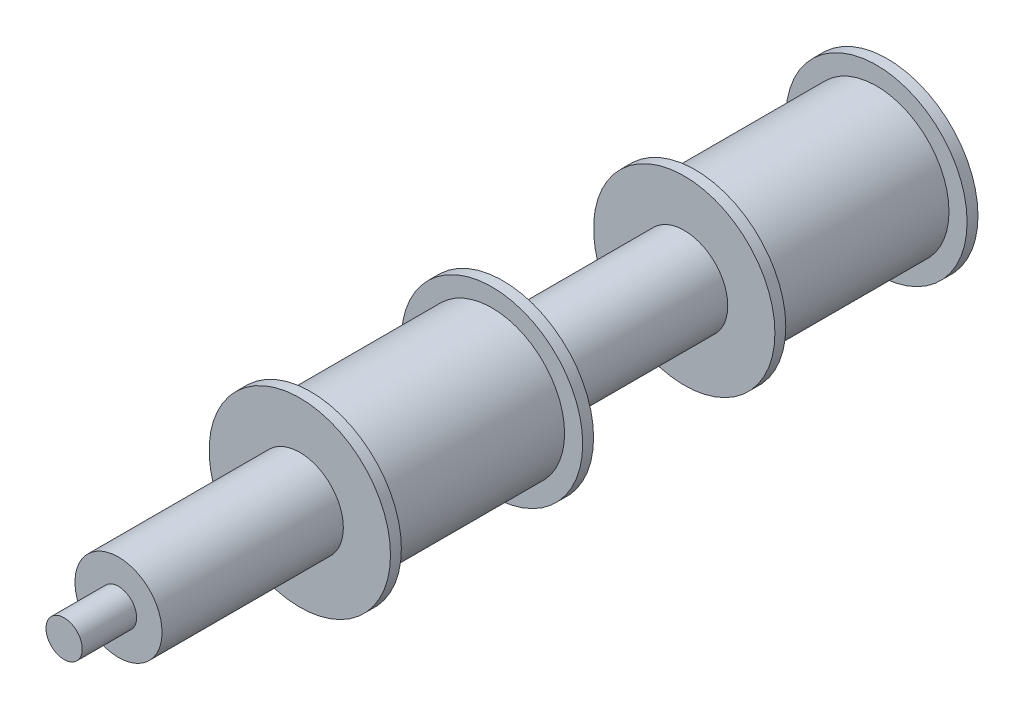
from build123d import *

# Parameters (mm, degrees)
SKETCH_1_R      = 25
EXTRUDE_1_DEPTH = 3
SKETCH_2_R      = 20
EXTRUDE_2_DEPTH = 50
SKETCH_3_R      = 25
EXTRUDE_3_DEPTH = 3
SKETCH_4_R      = 12
EXTRUDE_4_DEPTH = 50
SKETCH_5_R      = 25
EXTRUDE_5_DEPTH = 3
SKETCH_6_R      = 20
EXTRUDE_6_DEPTH = 50
SKETCH_8_R      = 25
EXTRUDE_7_DEPTH = 3
SKETCH_9_R      = 12
EXTRUDE_8_DEPTH = 50
SKETCH_10_R     = 5
EXTRUDE_9_DEPTH = 15


with BuildPart() as part:
    # 草图1 → 凸台-拉伸1 (new body)
    with BuildSketch(Plane.XY):
        Circle(SKETCH_1_R)
    extrude(amount=EXTRUDE_1_DEPTH)

    # 草图2 → 凸台-拉伸2 (add)
    with BuildSketch(Plane.XY.offset(3)):
        Circle(SKETCH_2_R)
    extrude(amount=EXTRUDE_2_DEPTH)

    # 草图3 → 凸台-拉伸3 (add)
    with BuildSketch(Plane.XY.offset(53)):
        Circle(SKETCH_3_R)
    extrude(amount=EXTRUDE_3_DEPTH)

    # 草图4 → 凸台-拉伸4 (add)
    with BuildSketch(Plane.XY.offset(56)):
        Circle(SKETCH_4_R)
    extrude(amount=EXTRUDE_4_DEPTH)

    # 草图5 → 凸台-拉伸5 (add)
    with BuildSketch(Plane.XY.offset(106)):
        Circle(SKETCH_5_R)
    extrude(amount=EXTRUDE_5_DEPTH)

    # 草图6 → 凸台-拉伸6 (add)
    with BuildSketch(Plane.XY.offset(109)):
        Circle(SKETCH_6_R)
    extrude(amount=EXTRUDE_6_DEPTH)

    # 草图8 → 凸台-拉伸7 (add)
    with BuildSketch(Plane.XY.offset(159)):
        Circle(SKETCH_8_R)
    extrude(amount=EXTRUDE_7_DEPTH)

    # 草图9 → 凸台-拉伸8 (add)
    with BuildSketch(Plane.XY.offset(162)):
        Circle(SKETCH_9_R)
    extrude(amount=EXTRUDE_8_DEPTH)

    # 草图10 → 凸台-拉伸9 (add)
    with BuildSketch(Plane.XY.offset(212)):
        Circle(SKETCH_10_R)
    extrude(amount=EXTRUDE_9_DEPTH)


solid = part.part
